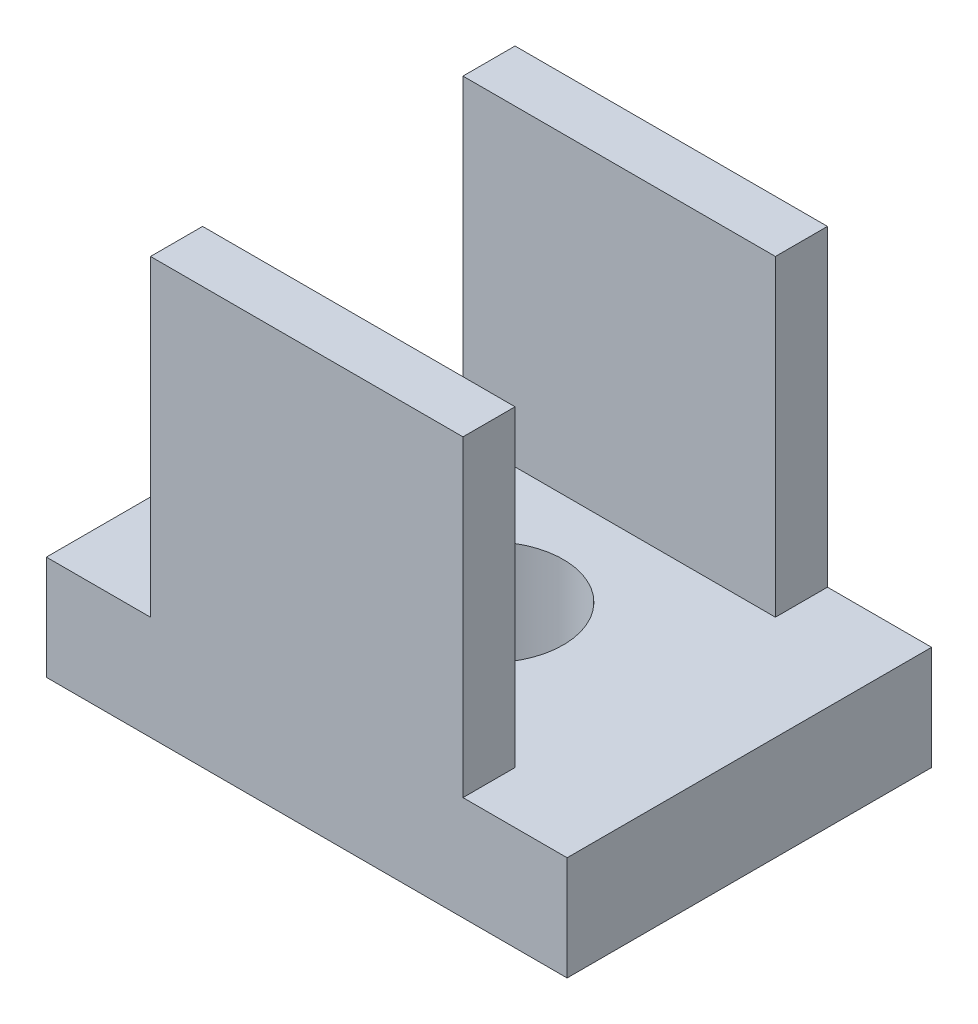
from build123d import *

# Parameters (mm, degrees)
SKETCH1_W           = 10
SKETCH1_H           = 7
BOSS_EXTRUDE1_DEPTH = 2
SKETCH2_R           = 1.425
CUT_EXTRUDE1_DEPTH  = 2
SKETCH4_W           = 6
SKETCH4_H           = 1
BOSS_EXTRUDE2_DEPTH = 6


with BuildPart() as part:
    # Sketch1 → Boss-Extrude1 (new body)
    with BuildSketch(Plane(origin=(0, 0, 0), x_dir=(1, 0, 0), z_dir=(0, 1, 0))):
        Rectangle(SKETCH1_W, SKETCH1_H)
    extrude(amount=BOSS_EXTRUDE1_DEPTH)

    # Sketch2 → Cut-Extrude1 (cut)
    with BuildSketch(Plane(origin=(0, 2, 0), x_dir=(1, 0, 0), z_dir=(0, 1, 0))):
        with Locations(Location((0, 0, 0), (0, 0, 270))):
            Circle(SKETCH2_R)
    extrude(amount=-CUT_EXTRUDE1_DEPTH, mode=Mode.SUBTRACT)

    # Sketch4 → Boss-Extrude2 (add)
    with BuildSketch(Plane(origin=(0, 2, 0), x_dir=(1, 0, 0), z_dir=(0, 1, 0))):
        with Locations((0, 3)):
            Rectangle(SKETCH4_W, SKETCH4_H)
        with Locations((0, -3)):
            Rectangle(SKETCH4_W, SKETCH4_H)
    extrude(amount=BOSS_EXTRUDE2_DEPTH)


solid = part.part
